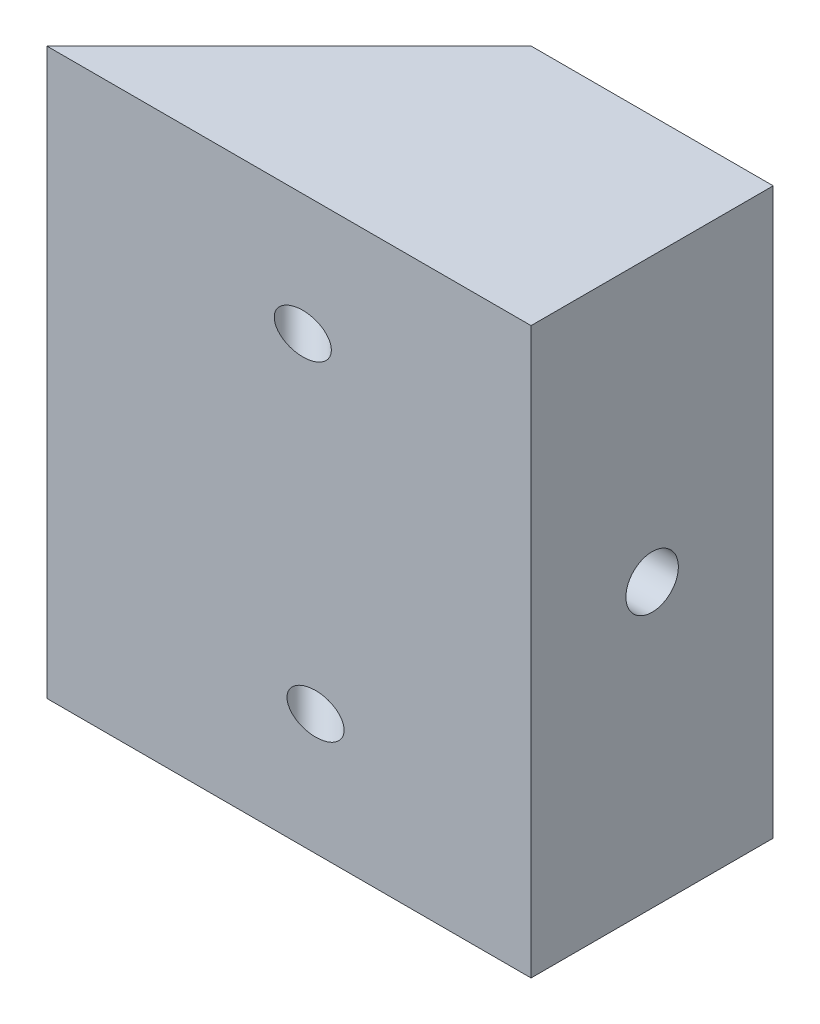
from build123d import *

# Parameters (mm, degrees)
BOSS_EXTRUDE1_DEPTH = 88.9
SKETCH2_R           = 3.175
CUT_EXTRUDE1_DEPTH  = 38.1
SKETCH3_R           = 4.1275
CUT_EXTRUDE2_DEPTH  = 25.4


with BuildPart() as part:
    # Sketch1 → Boss-Extrude1 (new body)
    with BuildSketch(Plane(origin=(0, 0, 0), x_dir=(1, 0, 0), z_dir=(0, 1, 0))):
        Polygon((0, 0), (38.1, 38.1), (76.2, 38.1), (76.2, 0), align=None)
    extrude(amount=BOSS_EXTRUDE1_DEPTH)

    # Sketch2 → Cut-Extrude1 (cut)
    with BuildSketch(Plane(origin=(38.1, 0, 38.1), x_dir=(-0.7071067811865464, 0, 0.7071067811865488), z_dir=(-0.7071067811865488, 0, -0.7071067811865464))):
        with Locations(Location((-28.481536726, 69.85, 0), (0, 0, 180))):
            Circle(SKETCH2_R)
        with Locations(Location((-29.901764766, 19.05, 0), (0, 0, 180))):
            Circle(SKETCH2_R)
    extrude(amount=CUT_EXTRUDE1_DEPTH, mode=Mode.SUBTRACT)

    # Sketch3 → Cut-Extrude2 (cut)
    with BuildSketch(Plane(origin=(76.2, 0, 0), x_dir=(0, 0, -1), z_dir=(1, 0, 0))):
        with Locations((19.05, 44.45)):
            Circle(SKETCH3_R)
    extrude(amount=-CUT_EXTRUDE2_DEPTH, mode=Mode.SUBTRACT)


solid = part.part
